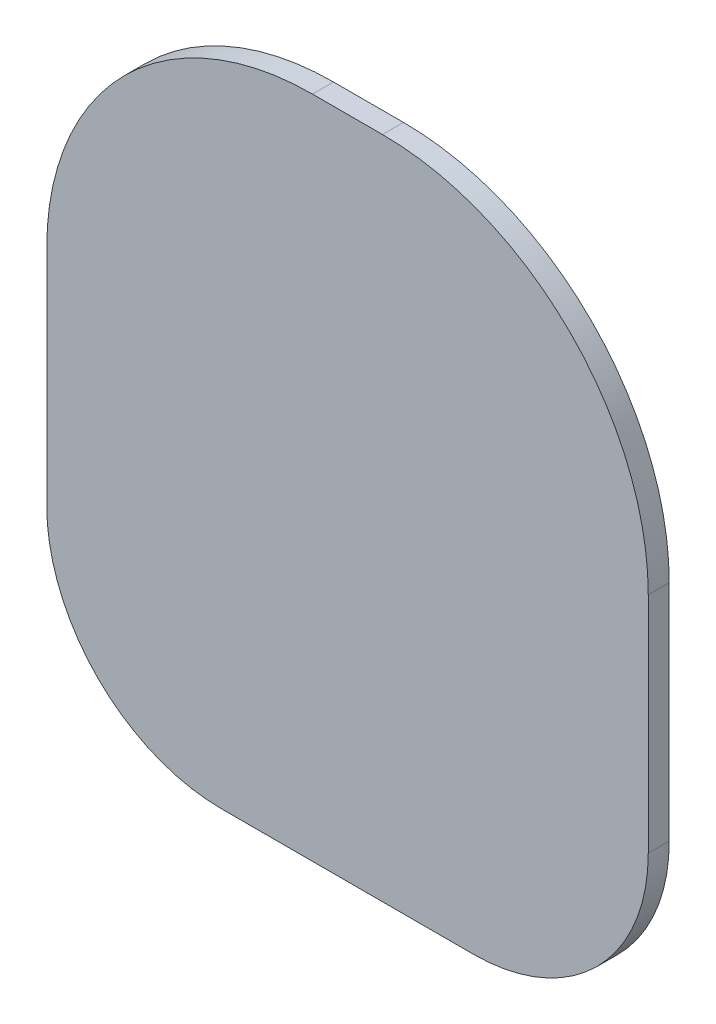
from build123d import *

# Parameters (mm, degrees)
BOSS_EXTRUDE1_DEPTH = 3


with BuildPart() as part:
    # Sketch1 → Boss-Extrude1 (new body)
    with BuildSketch(Plane.XY):
        with BuildLine():
            Line((-5, 8.5), (5, 8.5))
            ThreePointArc((5, 8.5), (31.870057685, -2.629942315), (43, -29.5))
            Line((43, -29.5), (43, -61.5))
            ThreePointArc((43, -61.5), (35.67766953, -79.17766953), (18, -86.5))
            Line((18, -86.5), (0.5, -86.5))
            Line((0.5, -86.5), (-0.5, -86.5))
            Line((-0.5, -86.5), (-18, -86.5))
            ThreePointArc((-18, -86.5), (-35.67766953, -79.17766953), (-43, -61.5))
            Line((-43, -61.5), (-43, -29.5))
            ThreePointArc((-43, -29.5), (-31.870057685, -2.629942315), (-5, 8.5))
        make_face()
    extrude(amount=BOSS_EXTRUDE1_DEPTH)


solid = part.part
